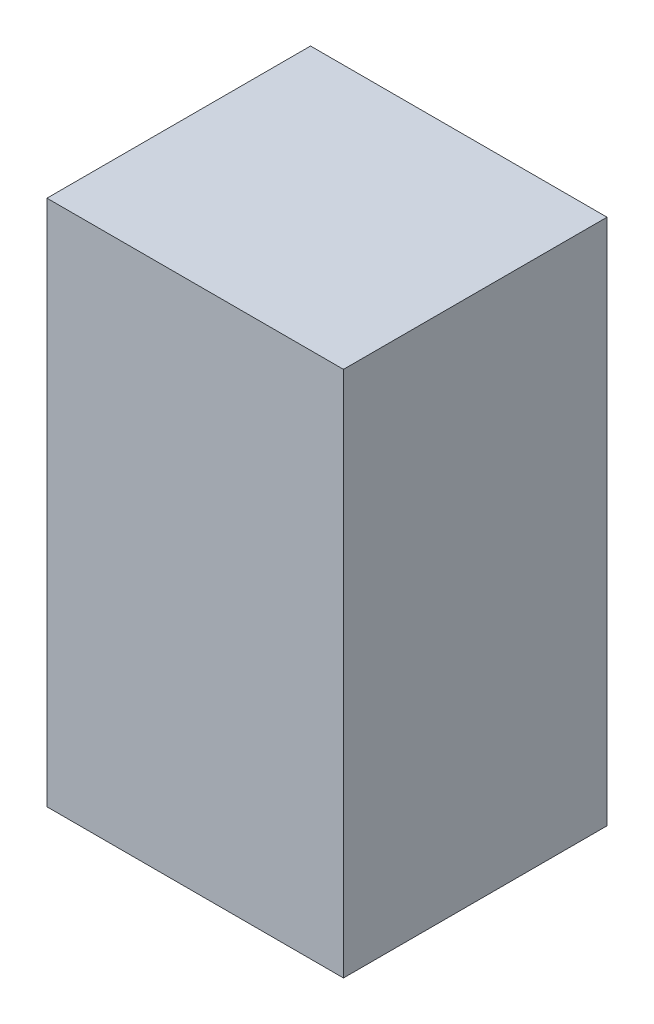
from build123d import *

# Parameters (mm, degrees)
OVEN_PANO_SSR_1_1_START = -208
SKETCH1_W               = 45
SKETCH1_H               = 80
OVEN_PANO_SSR_1_1_DEPTH = 40


with BuildPart() as part:
    # Sketch1 → OVEN_pano_SSR_1_1 (new body)
    with BuildSketch(Plane.XY.offset(OVEN_PANO_SSR_1_1_START)):
        with Locations((542.5, 260)):
            Rectangle(SKETCH1_W, SKETCH1_H)
    extrude(amount=-OVEN_PANO_SSR_1_1_DEPTH)


solid = part.part
